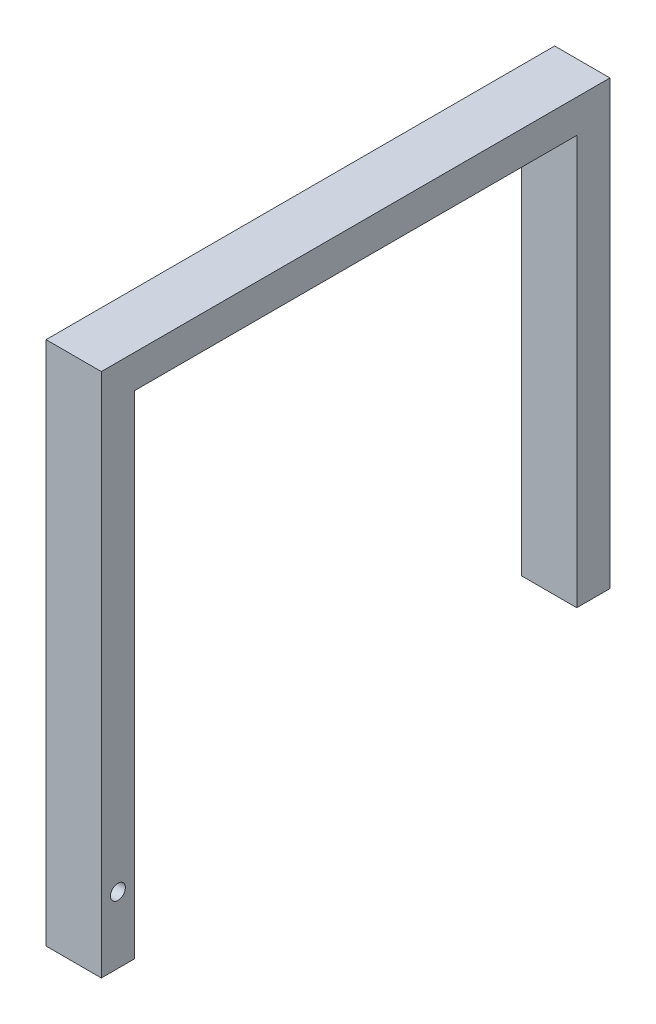
from build123d import *

# Parameters (mm, degrees)
SKETCH1_W           = 10
SKETCH1_H           = 6
BOSS_EXTRUDE1_DEPTH = 40
SKETCH7_W           = 10
SKETCH7_H           = 80
BOSS_EXTRUDE3_DEPTH = 6
SKETCH8_W           = 10
SKETCH8_H           = 6
BOSS_EXTRUDE4_DEPTH = 95
SKETCH9_R           = 1.35
CUT_EXTRUDE3_DEPTH  = 80


with BuildPart() as part:
    # Sketch1 → Boss-Extrude1 (new, symmetric)
    with BuildSketch(Plane(origin=(0, 0, 0), x_dir=(1, 0, 0), z_dir=(0, 1, 0))):
        Rectangle(SKETCH1_W, SKETCH1_H)
    extrude(amount=BOSS_EXTRUDE1_DEPTH, both=True)

    # Sketch7 → Boss-Extrude3 (add)
    with BuildSketch(Plane(origin=(0, 40, 0), x_dir=(1, 0, 0), z_dir=(0, 1, 0))):
        with Locations((0, -43)):
            Rectangle(SKETCH7_W, SKETCH7_H)
    extrude(amount=-BOSS_EXTRUDE3_DEPTH)

    # Sketch8 → Boss-Extrude4 (add)
    with BuildSketch(Plane(origin=(0, 40, 0), x_dir=(1, 0, 0), z_dir=(0, 1, 0))):
        with Locations((0, -86)):
            Rectangle(SKETCH8_W, SKETCH8_H)
    extrude(amount=-BOSS_EXTRUDE4_DEPTH)

    # Sketch9 → Cut-Extrude3 (cut)
    with BuildSketch(Plane(origin=(5, 0, 0), x_dir=(0, 0, -1), z_dir=(1, 0, 0))):
        with Locations((-86, -43)):
            Circle(SKETCH9_R)
    extrude(amount=-CUT_EXTRUDE3_DEPTH, mode=Mode.SUBTRACT)


solid = part.part
